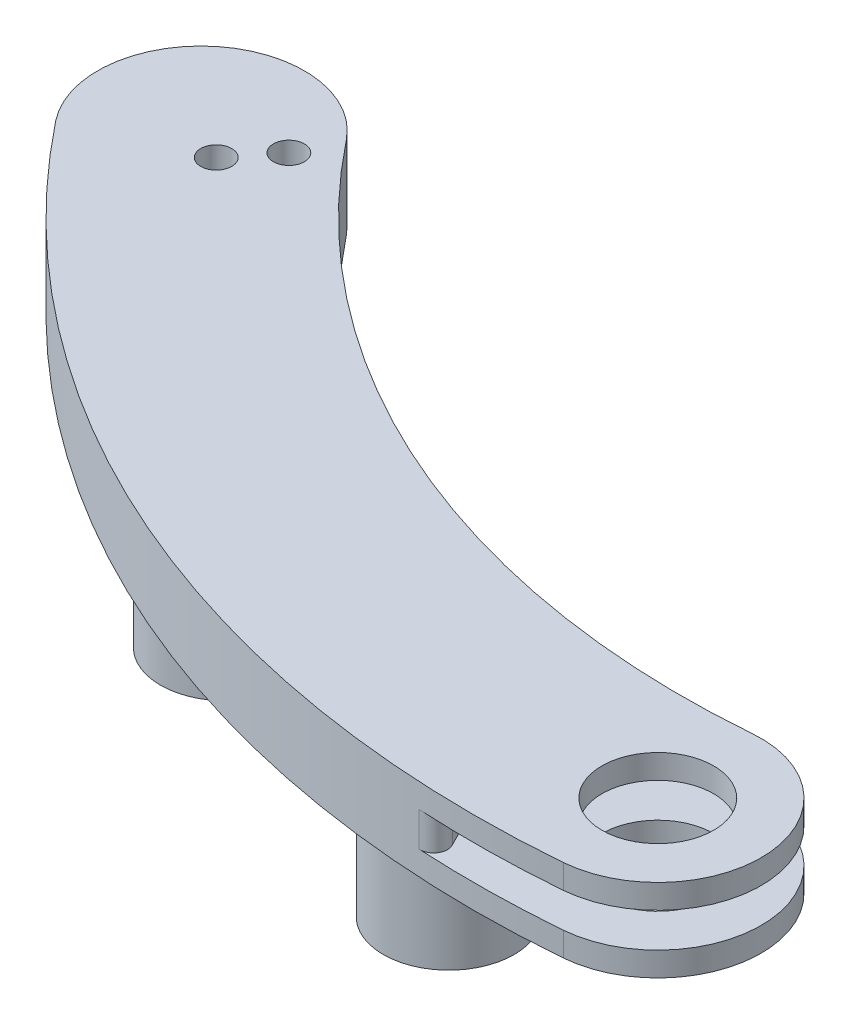
from build123d import *

# Parameters (mm, degrees)
BOSS_EXTRUDE4_DEPTH = 11.999999999999996
BOSS_EXTRUDE5_DEPTH = 3.5
BOSS_EXTRUDE6_DEPTH = 12
CUT_EXTRUDE2_DEPTH  = 8.5
BOSS_EXTRUDE7_DEPTH = 3.5000000000000004
SKETCH2_R           = 8.1
CUT_EXTRUDE3_DEPTH  = 12
FILLET1_R           = 5
FILLET2_R           = 2
SKETCH3_R           = 2.2499999999999964
CUT_EXTRUDE4_DEPTH  = 12
SKETCH4_R           = 9.500000000000002
SKETCH4_R_2         = 8.1
SKETCH4_R_3         = 9.499999999999995
SKETCH4_R_4         = 8.099999999999993
BOSS_EXTRUDE8_DEPTH = 20


with BuildPart() as part:
    # Sketch1 → Boss-Extrude4 (new body)
    with BuildSketch(Plane(origin=(0, 0, 0), x_dir=(1, 0, 0), z_dir=(0, 1, 0))):
        with BuildLine():
            ThreePointArc((-105.23956914411866, 60.05130546378884), (-126.31086817026393, 62.500868149406244), (-128.76043085588134, 41.429569123260976))
            ThreePointArc((-128.76043085588134, 41.42956912326096), (-78.3921989201775, 0.4513014224205847), (-15.424890802752289, -15.400995588922257))
            ThreePointArc((-15.424890802752284, -15.400995588922251), (-20.878753235246265, -0.5691494549701637), (-16.67921047602729, 14.665420305521598))
            ThreePointArc((-16.679210476027265, 14.665420305521593), (-65.8857769449076, 27.74562513419724), (-105.23956914411866, 60.05130546378885))
        make_face()
    extrude(amount=BOSS_EXTRUDE4_DEPTH)

    # Sketch1<6> → Boss-Extrude5 (add)
    with BuildSketch(Plane(origin=(0, 0, 0), x_dir=(1, 0, 0), z_dir=(0, 1, 0))):
        with BuildLine():
            ThreePointArc((-16.67921047602729, 14.665420305521598), (-20.878753235246265, -0.5691494549701637), (-15.424890802752284, -15.400995588922251))
            ThreePointArc((-15.424890802752289, -15.400995588922257), (-7.086372530747029, -15.406529466177687), (1.2395691441186596, -14.94869453621115))
            ThreePointArc((1.2395691441186607, -14.948694536211157), (14.948694536211152, 1.2395691441186514), (-1.2395691441186483, 14.948694536211152))
            ThreePointArc((-1.2395691441186347, 14.94869453621115), (-8.954828429393212, 14.55844291928571), (-16.679210476027265, 14.665420305521593))
        make_face()
    extrude(amount=BOSS_EXTRUDE5_DEPTH)

    # Sketch1<8> → Boss-Extrude6 (add)
    with BuildSketch(Plane(origin=(0, 0, 0), x_dir=(1, 0, 0), z_dir=(0, 1, 0))):
        with BuildLine():
            ThreePointArc((-16.67921047602729, 14.665420305521598), (-20.878753235246265, -0.5691494549701637), (-15.424890802752284, -15.400995588922251))
            ThreePointArc((-15.424890802752289, -15.400995588922257), (-7.086372530747029, -15.406529466177687), (1.2395691441186596, -14.94869453621115))
            ThreePointArc((1.2395691441186607, -14.948694536211157), (14.948694536211152, 1.2395691441186514), (-1.2395691441186483, 14.948694536211152))
            ThreePointArc((-1.2395691441186347, 14.94869453621115), (-8.954828429393212, 14.55844291928571), (-16.679210476027265, 14.665420305521593))
        make_face()
    extrude(amount=BOSS_EXTRUDE6_DEPTH)

    # Sketch1<9> → Cut-Extrude2 (cut)
    with BuildSketch(Plane(origin=(0, 0, 0), x_dir=(1, 0, 0), z_dir=(0, 1, 0))):
        with BuildLine():
            ThreePointArc((-16.67921047602729, 14.665420305521598), (-20.878753235246265, -0.5691494549701637), (-15.424890802752284, -15.400995588922251))
            ThreePointArc((-15.424890802752289, -15.400995588922257), (-7.086372530747029, -15.406529466177687), (1.2395691441186596, -14.94869453621115))
            ThreePointArc((1.2395691441186607, -14.948694536211157), (14.948694536211152, 1.2395691441186514), (-1.2395691441186483, 14.948694536211152))
            ThreePointArc((-1.2395691441186347, 14.94869453621115), (-8.954828429393212, 14.55844291928571), (-16.679210476027265, 14.665420305521593))
        make_face()
    extrude(amount=CUT_EXTRUDE2_DEPTH, mode=Mode.SUBTRACT)

    # Sketch1<10> → Boss-Extrude7 (add)
    with BuildSketch(Plane(origin=(0, 0, 0), x_dir=(1, 0, 0), z_dir=(0, 1, 0))):
        with BuildLine():
            ThreePointArc((-16.67921047602729, 14.665420305521598), (-20.878753235246265, -0.5691494549701637), (-15.424890802752284, -15.400995588922251))
            ThreePointArc((-15.424890802752289, -15.400995588922257), (-7.086372530747029, -15.406529466177687), (1.2395691441186596, -14.94869453621115))
            ThreePointArc((1.2395691441186607, -14.948694536211157), (14.948694536211152, 1.2395691441186514), (-1.2395691441186483, 14.948694536211152))
            ThreePointArc((-1.2395691441186347, 14.94869453621115), (-8.954828429393212, 14.55844291928571), (-16.679210476027265, 14.665420305521593))
        make_face()
    extrude(amount=BOSS_EXTRUDE7_DEPTH)

    # Sketch2 → Cut-Extrude3 (cut)
    with BuildSketch(Plane(origin=(0, 11.999999999999996, 0), x_dir=(1, 0, 0), z_dir=(0, 1, 0))):
        Circle(SKETCH2_R)
    extrude(amount=-CUT_EXTRUDE3_DEPTH, mode=Mode.SUBTRACT)

    # Fillet1
    fillet1_edges = [part.edges().sort_by_distance(p)[0] for p in [
        (-16.67921047602728, 6, -14.665420305521597),
    ]]
    fillet(fillet1_edges, radius=FILLET1_R)

    # Fillet2
    fillet2_edges = [part.edges().sort_by_distance(p)[0] for p in [
        (-15.424890802752289, 6, 15.400995588922266),
    ]]
    fillet(fillet2_edges, radius=FILLET2_R)

    # Sketch3 → Cut-Extrude4 (cut)
    with BuildSketch(Plane(origin=(0, 11.999999999999996, 0), x_dir=(1, 0, 0), z_dir=(0, 1, 0))):
        with Locations((-107.81660725396851, 54.30249040498051)):
            Circle(SKETCH3_R)
        with Locations((-112.49908312253997, 48.44378579216329)):
            Circle(SKETCH3_R)
    extrude(amount=-CUT_EXTRUDE4_DEPTH, mode=Mode.SUBTRACT)

    # Sketch4 → Boss-Extrude8 (add)
    # profile 1 of 2: a face of its own
    with BuildSketch(Plane(origin=(0, 0, 0), x_dir=(1, 0, 0), z_dir=(0, 1, 0))):
        with Locations((-32.24716798080135, 1.9278264844930209)):
            Circle(SKETCH4_R)
        with Locations((-32.24716798080135, 1.9278264844930209)):
            Circle(SKETCH4_R_2, mode=Mode.SUBTRACT)
    # profile 2 of 2: a face of its own
    with BuildSketch(Plane(origin=(0, 0, 0), x_dir=(1, 0, 0), z_dir=(0, 1, 0))):
        with Locations((-82.24716798080135, 19.60428986869888)):
            Circle(SKETCH4_R_3)
        with Locations((-82.24716798080135, 19.60428986869888)):
            Circle(SKETCH4_R_4, mode=Mode.SUBTRACT)
    extrude(amount=-BOSS_EXTRUDE8_DEPTH)


solid = part.part
